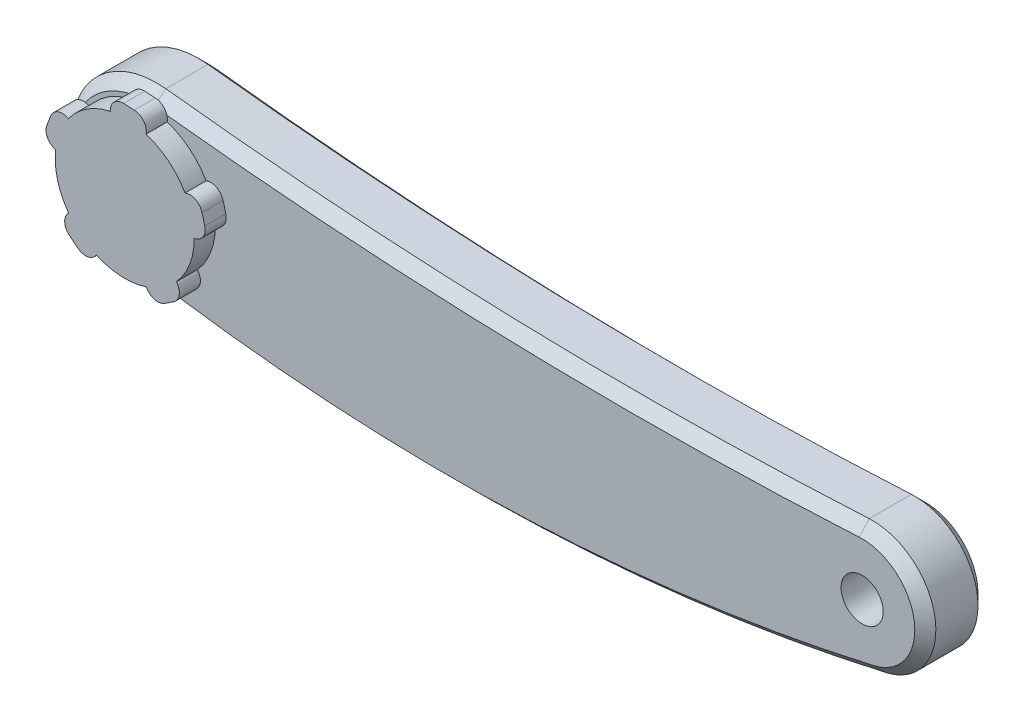
from build123d import *

# Parameters (mm, degrees)
BOSS_EXTRUDE1_DEPTH = 7.5
CHAMFER1_SIZE       = 2.5
SKETCH2_R           = 16.5
BOSS_EXTRUDE2_DEPTH = 5
BOSS_EXTRUDE3_START = -5
BOSS_EXTRUDE3_DEPTH = 5
SKETCH4_R           = 5
CUT_EXTRUDE1_DEPTH  = 10
SKETCH5_R           = 5
BOSS_EXTRUDE4_DEPTH = 10


with BuildPart() as part:
    # Sketch1 → Boss-Extrude1 (new, symmetric)
    with BuildSketch(Plane.XY):
        with BuildLine():
            ThreePointArc((169.186105477, 14.977902914), (85.617423728, 13.934366249), (2.253460208, 19.872642429))
            ThreePointArc((2.253460208, 19.872642429), (-19.801791361, 2.808746854), (-3.361833105, -19.715427415))
            ThreePointArc((-3.361833105, -19.715427415), (85.256800738, -25.931146508), (173.369675456, -14.61660998))
            ThreePointArc((173.369675456, -14.61660998), (184.852333231, 2.099570811), (169.186105477, 14.977902914))
        make_face()
    extrude(amount=BOSS_EXTRUDE1_DEPTH, both=True)

    # Chamfer1
    chamfer1_edges = [part.edges().sort_by_distance(p)[0] for p in [
        (85.617423728, 13.934366249, 7.5),
        (184.852333231, 2.099570811, 7.5),
        (184.852333231, 2.099570811, -7.5),
        (-19.801791361, 2.808746854, 7.5),
        (85.256800738, -25.931146508, 7.5),
        (-19.801791361, 2.808746854, -7.5),
        (85.617423728, 13.934366249, -7.5),
        (85.256800738, -25.931146508, -7.5),
    ]]
    chamfer(chamfer1_edges, length=CHAMFER1_SIZE)

    # Sketch2 → Boss-Extrude2 (add)
    with BuildSketch(Plane.XY.offset(7.5)):
        Circle(SKETCH2_R)
    extrude(amount=BOSS_EXTRUDE2_DEPTH)

    # Sketch3 → Boss-Extrude3 (add)
    with BuildSketch(Plane.XY.offset(12.5).offset(BOSS_EXTRUDE3_START)):
        with BuildLine():
            ThreePointArc((-0.253915773, 19.358335376), (-2.55345676, 18.462340064), (-3.403051231, 16.145254483))
            ThreePointArc((-3.403051231, 16.145254483), (0.863543278, 16.477387323), (5.0720476, 15.701093374))
            ThreePointArc((5.0720476, 15.701093374), (4.469308692, 18.094292522), (2.276021844, 19.225746964))
            Line((2.276021844, 19.225746964), (-0.253915773, 19.358335376))
        make_face()
        with BuildLine():
            ThreePointArc((14.30344882, 8.225652062), (15.249383609, 6.301293481), (15.937776134, 4.270514244))
            Line((15.937776134, 4.270514244), (18.660254038, 5))
            Line((18.660254038, 5), (18.332406715, 6.223542865))
            ThreePointArc((18.332406715, 6.223542865), (16.76966729, 8.133658527), (14.30344882, 8.225652062))
        make_face()
        with BuildLine():
            Line((18.660254038, 5), (15.937776134, 4.270514244))
            ThreePointArc((15.937776134, 4.270514244), (16.357000338, 2.167611574), (16.499976071, 0.028100762))
            ThreePointArc((16.499976071, 0.028100762), (18.58978715, 1.340878735), (18.98810136, 3.776457135))
            Line((18.98810136, 3.776457135), (18.660254038, 5))
        make_face()
        with BuildLine():
            ThreePointArc((11.583966219, -15.511974356), (12.917681126, -13.435462641), (12.243068758, -11.061521929))
            ThreePointArc((12.243068758, -11.061521929), (8.986544078, -13.838064371), (5.125498425, -15.683726148))
            ThreePointArc((5.125498425, -15.683726148), (7.01981161, -17.265583889), (9.459270178, -16.891768097))
            Line((9.459270178, -16.891768097), (11.583966219, -15.511974356))
        make_face()
        with BuildLine():
            ThreePointArc((-11.173121868, -15.810470249), (-8.786101299, -16.437231094), (-6.736816201, -15.062048582))
            ThreePointArc((-6.736816201, -15.062048582), (-10.383786452, -12.822908364), (-13.332243835, -9.721176591))
            ThreePointArc((-13.332243835, -9.721176591), (-14.25130498, -12.011596414), (-13.141950881, -14.21614395))
            Line((-13.141950881, -14.21614395), (-11.173121868, -15.810470249))
        make_face()
        with BuildLine():
            Line((0, 0), (-13.017345465, 9.457655082))
            ThreePointArc((-13.017345465, 9.457655082), (-15.632747256, 9.907063304), (-17.581442501, 8.105707948))
            Line((-17.581442501, 8.105707948), (-18.489335293, 5.740566364))
            ThreePointArc((-18.489335293, 5.740566364), (-18.246514507, 3.097966821), (-16.002179404, 1.681896829))
            Line((-16.002179404, 1.681896829), (0, 0))
        make_face()
    extrude(amount=BOSS_EXTRUDE3_DEPTH)

    # Sketch4 → Cut-Extrude1 (cut)
    with BuildSketch(Plane.XY.offset(7.5)):
        with Locations((170, 0)):
            Circle(SKETCH4_R)
    extrude(amount=-CUT_EXTRUDE1_DEPTH, mode=Mode.SUBTRACT)

    # Sketch5 → Boss-Extrude4 (add)
    with BuildSketch(Plane(origin=(0, 0, -7.5), x_dir=(-1, 0, 0), z_dir=(0, 0, -1))):
        with Locations(Location((0, 0, 0), (0, 0, 180))):
            Circle(SKETCH5_R)
    extrude(amount=BOSS_EXTRUDE4_DEPTH)


solid = part.part
